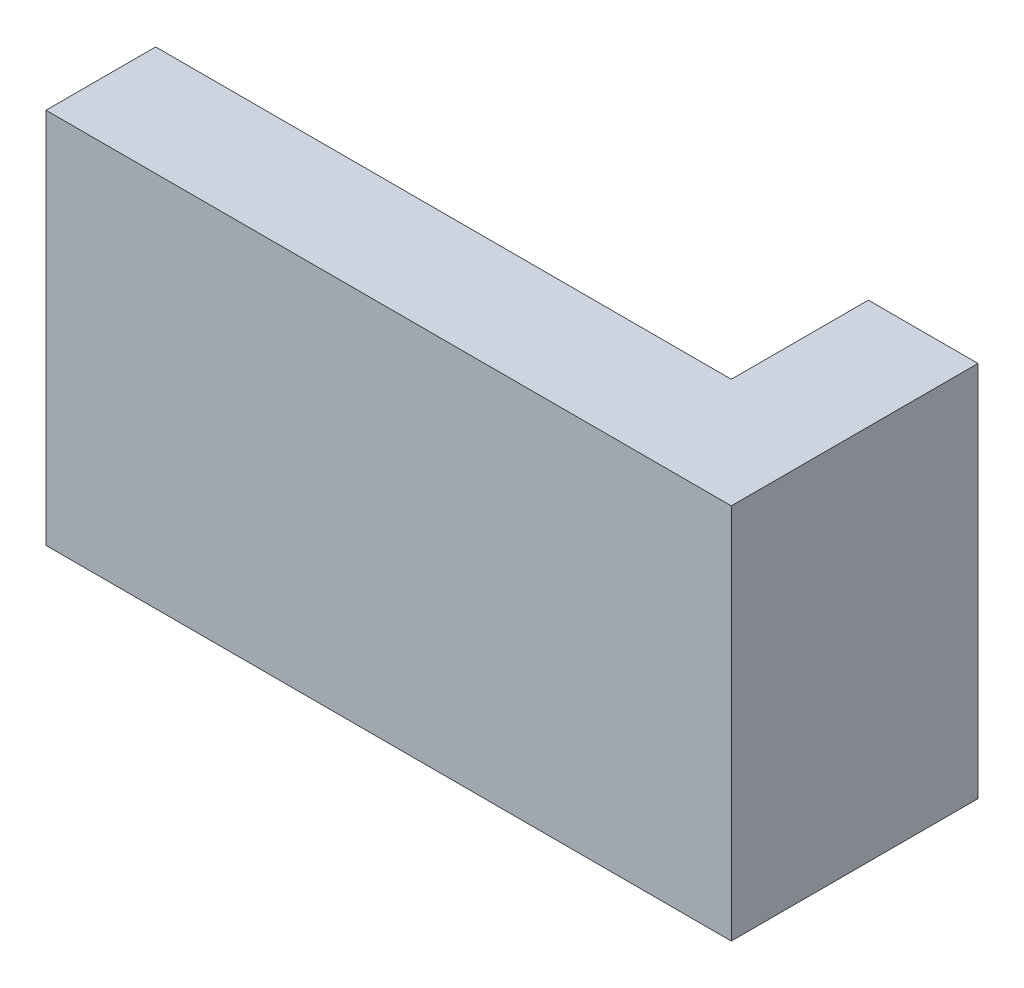
from build123d import *

# Parameters (mm, degrees)
SKETCH2_W           = 10
SKETCH2_H           = 5.5
BOSS_EXTRUDE1_DEPTH = 1.6
SKETCH3_W           = 1.6
SKETCH3_H           = 5.5
BOSS_EXTRUDE2_DEPTH = 2


with BuildPart() as part:
    # Sketch2 → Boss-Extrude1 (new body)
    with BuildSketch(Plane.XY):
        with Locations((-14.212598425, 6.659448819)):
            Rectangle(SKETCH2_W, SKETCH2_H)
    extrude(amount=BOSS_EXTRUDE1_DEPTH)

    # Sketch3 → Boss-Extrude2 (add)
    with BuildSketch(Plane(origin=(0, 0, 0), x_dir=(-1, 0, 0), z_dir=(0, 0, -1))):
        with Locations((10.012598425, 6.659448819)):
            Rectangle(SKETCH3_W, SKETCH3_H)
    extrude(amount=BOSS_EXTRUDE2_DEPTH)


solid = part.part
